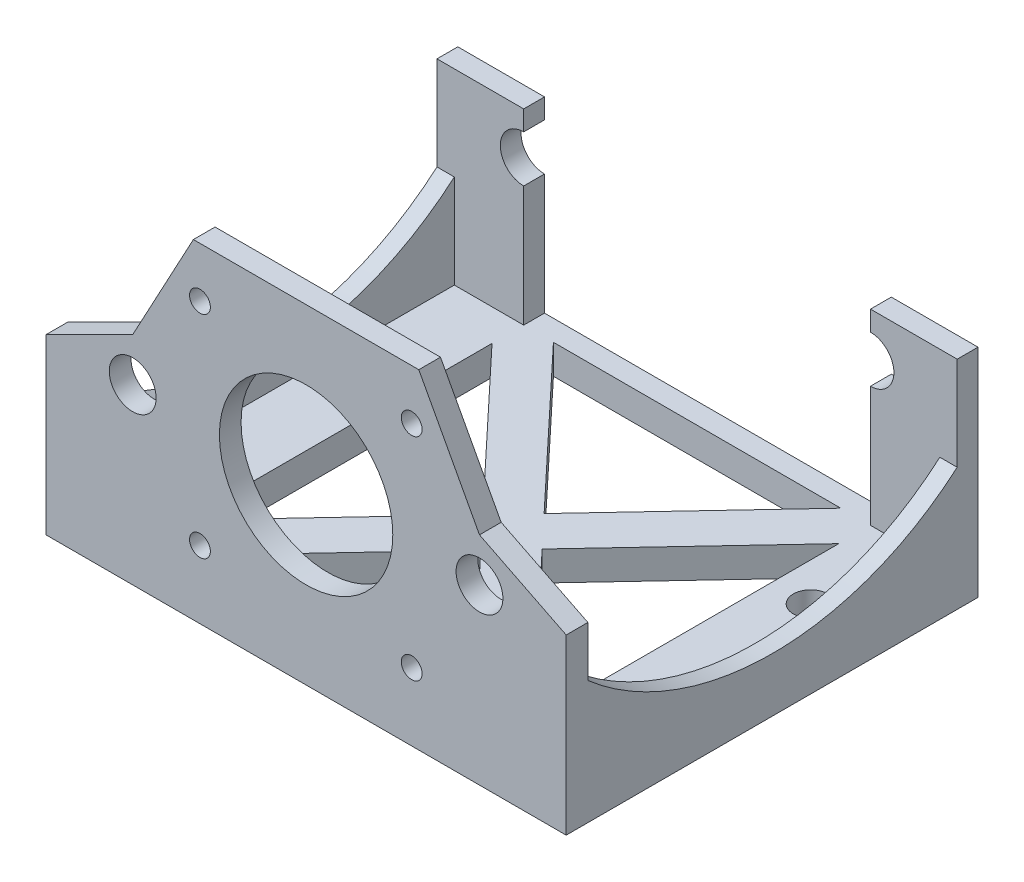
from build123d import *

# Parameters (mm, degrees)
SKETCH1_R           = 1.27
SKETCH1_R_2         = 9.525
SKETCH1_R_3         = 3.175
BOSS_EXTRUDE1_DEPTH = 3.175
SKETCH2_W           = 76.2
SKETCH2_H           = 4.318
BOSS_EXTRUDE2_DEPTH = 54.102
BOSS_EXTRUDE3_START = 3.048
SKETCH3_W           = 76.2
SKETCH3_H           = 4.318
BOSS_EXTRUDE3_DEPTH = 3.048
SKETCH10_W          = 54.102
SKETCH10_H          = 13.716
BOSS_EXTRUDE7_DEPTH = 2.54
SKETCH5_R           = 3.429
SKETCH5_R_2         = 3.175
SKETCH5_R_3         = 1.524
SKETCH5_R_4         = 1.27
SKETCH5_R_5         = 9.779
SKETCH5_R_6         = 9.525
CUT_EXTRUDE2_DEPTH  = 76.735563806
CUT_EXTRUDE3_DEPTH  = 83.935570318
SKETCH7_R           = 12.7
CUT_EXTRUDE4_DEPTH  = 76.735563806
CUT_EXTRUDE5_DEPTH  = 99.578509321
CUT_EXTRUDE6_REACH  = 75.232
SKETCH15_R          = 2.54
CUT_EXTRUDE7_DEPTH  = 82.53914314


with BuildPart() as part:
    # Sketch1 → Boss-Extrude1 (new body)
    with BuildSketch(Plane.XY):
        Polygon((31.75, 25.4), (25.4, 25.4), (25.4, 22.86), (-25.4, 22.86), (-25.4, 25.4), (-31.75, 25.4), (-38.1, 0), (-38.1, -25.4), (38.1, -25.4), (38.1, 0), align=None)
        with Locations((-15.5448, 15.5186)):
            Circle(SKETCH1_R, mode=Mode.SUBTRACT)
        with Locations((15.4686, 15.5186)):
            Circle(SKETCH1_R, mode=Mode.SUBTRACT)
        with Locations((15.4686, -15.4678)):
            Circle(SKETCH1_R, mode=Mode.SUBTRACT)
        with Locations((-15.5448, -15.4678)):
            Circle(SKETCH1_R, mode=Mode.SUBTRACT)
        Circle(SKETCH1_R_2, mode=Mode.SUBTRACT)
        with Locations((-25.4, 0)):
            Circle(SKETCH1_R_3, mode=Mode.SUBTRACT)
        with Locations(Location((25.4, 0, 0), (0, 0, 180))):
            Circle(SKETCH1_R_3, mode=Mode.SUBTRACT)
    extrude(amount=BOSS_EXTRUDE1_DEPTH)

    # Sketch2 → Boss-Extrude2 (add)
    with BuildSketch(Plane(origin=(0, 0, 0), x_dir=(-1, 0, 0), z_dir=(0, 0, -1))):
        with Locations((0, -23.241)):
            Rectangle(SKETCH2_W, SKETCH2_H)
    extrude(amount=BOSS_EXTRUDE2_DEPTH)

    # Sketch3 → Boss-Extrude3 (add)
    with BuildSketch(Plane(origin=(0, 0, -54.102), x_dir=(-1, 0, 0), z_dir=(0, 0, -1)).offset(BOSS_EXTRUDE3_START)):
        with BuildLine():
            Line((-25.4, 6.35), (-38.1, 6.35))
            Line((-38.1, 6.35), (-38.1, -21.082))
            Line((-38.1, -21.082), (-25.4, -21.082))
            Line((-25.4, -21.082), (-25.4, -3.175))
            ThreePointArc((-25.4, -3.175), (-28.575, 0), (-25.4, 3.175))
            Line((-25.4, 3.175), (-25.4, 6.35))
        make_face()
        with BuildLine():
            Line((25.4, -3.175), (25.4, -21.082))
            Line((25.4, -21.082), (38.1, -21.082))
            Line((38.1, -21.082), (38.1, 6.35))
            Line((38.1, 6.35), (25.4, 6.35))
            Line((25.4, 6.35), (25.4, 3.175))
            ThreePointArc((25.4, 3.175), (27.64506403, 2.24506403), (28.575, 0))
            ThreePointArc((28.575, 0), (27.64506403, -2.24506403), (25.4, -3.175))
        make_face()
        with Locations((0, -23.241)):
            Rectangle(SKETCH3_W, SKETCH3_H)
    extrude(amount=-BOSS_EXTRUDE3_DEPTH)

    # Sketch10 → Boss-Extrude7 (add)
    with BuildSketch(Plane(origin=(38.1, 0, 0), x_dir=(0, 0, -1), z_dir=(1, 0, 0))):
        with Locations((27.051, -14.224)):
            Rectangle(SKETCH10_W, SKETCH10_H)
    boss_extrude7 = extrude(amount=-BOSS_EXTRUDE7_DEPTH)

    # Mirror4: Boss-Extrude7 across plane
    add(boss_extrude7.mirror(Plane(origin=(0, 0, 0), x_dir=(0, 0, 1), z_dir=(1, 0, 0))))

    # Sketch5 → Cut-Extrude2 (cut, through all)
    # profile 1 of 7: a face of its own
    with BuildSketch(Plane.XY.offset(3.175)):
        with Locations((-25.4, 0)):
            Circle(SKETCH5_R)
        with Locations((-25.4, 0)):
            Circle(SKETCH5_R_2, mode=Mode.SUBTRACT)
    # profile 2 of 7: a face of its own
    with BuildSketch(Plane.XY.offset(3.175)):
        with Locations((-15.5448, 15.5186)):
            Circle(SKETCH5_R_3)
        with Locations((-15.5448, 15.5186)):
            Circle(SKETCH5_R_4, mode=Mode.SUBTRACT)
    # profile 3 of 7: a face of its own
    with BuildSketch(Plane.XY.offset(3.175)):
        with Locations((15.4686, 15.5186)):
            Circle(SKETCH5_R_3)
        with Locations((15.4686, 15.5186)):
            Circle(SKETCH5_R_4, mode=Mode.SUBTRACT)
    # profile 4 of 7: a face of its own
    with BuildSketch(Plane.XY.offset(3.175)):
        Circle(SKETCH5_R_5)
        Circle(SKETCH5_R_6, mode=Mode.SUBTRACT)
    # profile 5 of 7: a face of its own
    with BuildSketch(Plane.XY.offset(3.175)):
        with Locations((25.4, 0)):
            Circle(SKETCH5_R)
        with Locations((25.4, 0)):
            Circle(SKETCH5_R_2, mode=Mode.SUBTRACT)
    # profile 6 of 7: a face of its own
    with BuildSketch(Plane.XY.offset(3.175)):
        with Locations((15.4686, -15.4678)):
            Circle(SKETCH5_R_3)
        with Locations((15.4686, -15.4678)):
            Circle(SKETCH5_R_4, mode=Mode.SUBTRACT)
    # profile 7 of 7: a face of its own
    with BuildSketch(Plane.XY.offset(3.175)):
        with Locations((-15.5448, -15.4678)):
            Circle(SKETCH5_R_3)
        with Locations((-15.5448, -15.4678)):
            Circle(SKETCH5_R_4, mode=Mode.SUBTRACT)
    extrude(amount=-CUT_EXTRUDE2_DEPTH, mode=Mode.SUBTRACT)

    # Sketch6 → Cut-Extrude3 (cut, through all)
    with BuildSketch(Plane(origin=(0, -21.082, 0), x_dir=(1, 0, 0), z_dir=(0, 1, 0))):
        Polygon((21.044738629, 54.102), (-21.044738629, 54.102), (0, 31.68935336), align=None)
        Polygon((-4.355261371, 27.051), (-25.4, 49.46364664), (-25.4, 4.63835336), align=None)
        Polygon((25.4, 4.63835336), (25.4, 49.46364664), (4.355261371, 27.051), align=None)
        Polygon((0, 22.41264664), (-21.044738629, 0), (21.044738629, 0), align=None)
    extrude(amount=-CUT_EXTRUDE3_DEPTH, mode=Mode.SUBTRACT)

    # Sketch7 → Cut-Extrude4 (cut, through all)
    with BuildSketch(Plane.XY.offset(3.175)):
        Circle(SKETCH7_R)
    extrude(amount=-CUT_EXTRUDE4_DEPTH, mode=Mode.SUBTRACT)

    # Sketch11 → Cut-Extrude5 (cut, through all)
    with BuildSketch(Plane(origin=(38.1, 0, 0), x_dir=(0, 0, -1), z_dir=(1, 0, 0))):
        with BuildLine():
            Line((0, -7.366), (54.102, -7.366))
            ThreePointArc((54.102, -7.366), (27.051, -17.462948896), (0, -7.366))
        make_face()
    extrude(amount=-CUT_EXTRUDE5_DEPTH, mode=Mode.SUBTRACT)

    # Sketch12 → Cut-Extrude6 (cut, up to next)
    with BuildSketch(Plane(origin=(0, 0, 0), x_dir=(-1, 0, 0), z_dir=(0, 0, -1)), mode=Mode.PRIVATE) as cut_extrude6_sk1:
        Polygon((25.4, 22.86), (16.51, 22.86), (25.4, 6.35), (38.1, 0), (31.75, 25.4), (25.4, 25.4), align=None)
    cut_extrude6_tool1 = extrude(cut_extrude6_sk1.sketch, amount=-CUT_EXTRUDE6_REACH, mode=Mode.PRIVATE) & part.part
    # Sketch12 → Cut-Extrude6 (cut, up to next)
    with BuildSketch(Plane(origin=(0, 0, 0), x_dir=(-1, 0, 0), z_dir=(0, 0, -1)), mode=Mode.PRIVATE) as cut_extrude6_sk2:
        Polygon((-25.4, 6.35), (-16.51, 22.86), (-25.4, 22.86), (-25.4, 25.4), (-31.75, 25.4), (-38.1, 0), align=None)
    cut_extrude6_tool2 = extrude(cut_extrude6_sk2.sketch, amount=-CUT_EXTRUDE6_REACH, mode=Mode.PRIVATE) & part.part
    add(cut_extrude6_tool1.solids().sort_by_distance((-28.333539, 14.25305, 0))[0], mode=Mode.SUBTRACT)
    add(cut_extrude6_tool2.solids().sort_by_distance((28.333539, 14.25305, 0))[0], mode=Mode.SUBTRACT)

    # Sketch15 → Cut-Extrude7 (cut, through all)
    with BuildSketch(Plane(origin=(0, -21.082, 0), x_dir=(1, 0, 0), z_dir=(0, 1, 0))):
        with Locations(Location((-30.988, 39.751, 0), (0, 0, 270))):
            Circle(SKETCH15_R)
        with Locations(Location((-30.988, 14.351, 0), (0, 0, 270))):
            Circle(SKETCH15_R)
        with Locations(Location((30.988, 14.351, 0), (0, 0, 90))):
            Circle(SKETCH15_R)
        with Locations(Location((30.988, 39.751, 0), (0, 0, 90))):
            Circle(SKETCH15_R)
    extrude(amount=-CUT_EXTRUDE7_DEPTH, mode=Mode.SUBTRACT)


solid = part.part
